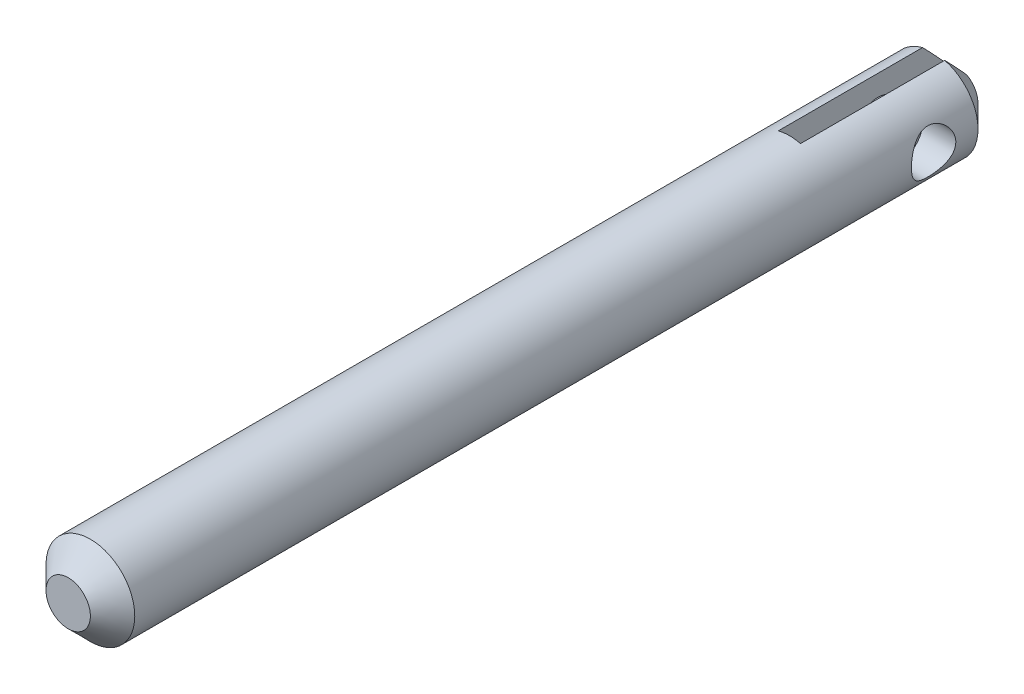
from build123d import *

# Parameters (mm, degrees)
SKETCH_1_R                 = 2
EXTRUDE_338_DEPTH          = 40
CHAMFER_1_SIZE             = 1
CUT_EXTRUDE_518_DEPTH      = 41.099875312
CUT_EXTRUDE_518_DEPTH_BACK = 41.099875312
SKETCH_2_W                 = 1
SKETCH_2_H                 = 7.5
CUT_EXTRUDE_2_DEPTH        = 41.099875312
CUT_EXTRUDE_2_DEPTH_BACK   = 41.099875312
SKETCH_3_R                 = 1


with BuildPart() as part:
    # Эскиз1 → Extrude 338 (new body)
    with BuildSketch(Plane.XY):
        Circle(SKETCH_1_R)
    extrude(amount=EXTRUDE_338_DEPTH)

    # Фаска1
    chamfer_1_edges = [part.edges().sort_by_distance(p)[0] for p in [
        (-2, 0, 0),
        (-2, 0, 40),
    ]]
    chamfer(chamfer_1_edges, length=CHAMFER_1_SIZE)

    # Эскиз2 → Cut-Extrude 518 (cut, two sides: drawn at the far end of the back side and taken through both)
    with BuildSketch(Plane(origin=(0, 0, 0), x_dir=(1, 0, 0), z_dir=(0, 1, 0)).offset(-CUT_EXTRUDE_518_DEPTH_BACK)):
        with Locations((0, -3.75)):
            Rectangle(SKETCH_2_W, SKETCH_2_H)
    extrude(amount=CUT_EXTRUDE_518_DEPTH + CUT_EXTRUDE_518_DEPTH_BACK, mode=Mode.SUBTRACT)

    # Эскиз3 → Вырез-Вытянуть2 (cut, two sides: drawn at the far end of the back side and taken through both)
    with BuildSketch(Plane(origin=(0, 0, 0), x_dir=(0, 0, -1), z_dir=(1, 0, 0)).offset(-CUT_EXTRUDE_2_DEPTH_BACK)):
        with Locations((-3, 0)):
            Circle(SKETCH_3_R)
    extrude(amount=CUT_EXTRUDE_2_DEPTH + CUT_EXTRUDE_2_DEPTH_BACK, mode=Mode.SUBTRACT)


solid = part.part
